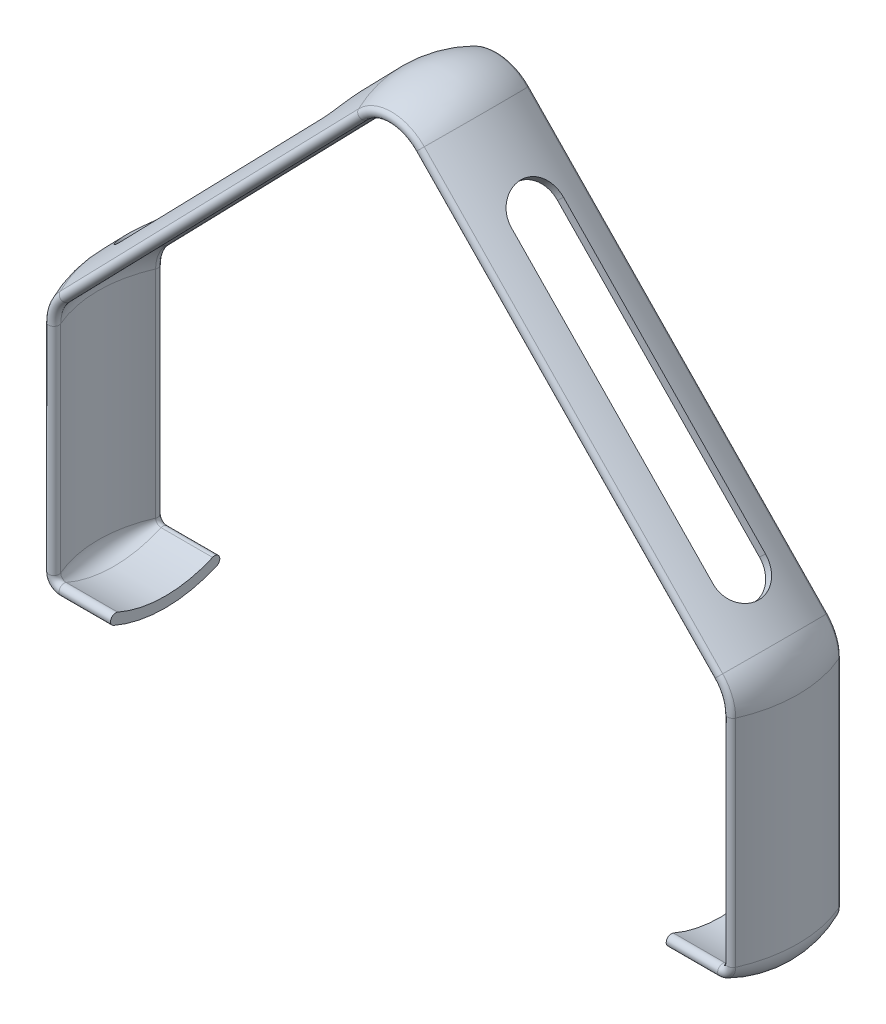
from build123d import *

# Parameters (mm, degrees)
CUT_EXTRUDE1_REACH      = 73.67
CUT_EXTRUDE1_END_RADIUS = 11.509727536


with BuildPart() as part:
    # Sweep3: sweep along a path in swept profile
    with BuildLine(Plane.XY) as sweep3_path:
        Line((27, 0), (32, 0))
        ThreePointArc((32, 0), (33.414213562, 0.585786438), (34, 2))
        Line((34, 2), (34, 22.971251236))
        ThreePointArc((34, 22.971251236), (33.633140648, 24.851146908), (32.586396904, 26.455179657))
        Line((32.586396904, 26.455179657), (3.586396904, 56.308120834))
        ThreePointArc((3.586396904, 56.308120834), (0, 57.824192412), (-3.586396904, 56.308120834))
        Line((-3.586396904, 56.308120834), (-32.586396904, 26.455179657))
        ThreePointArc((-32.586396904, 26.455179657), (-33.633140648, 24.851146908), (-34, 22.971251236))
        Line((-34, 22.971251236), (-34, 2))
        ThreePointArc((-34, 2), (-33.414213562, 0.585786438), (-32, 0))
        Line((-32, 0), (-27, 0))
    # guide line → Sweep3 (sweep)
    with BuildSketch(Plane(origin=(27, 0, 0), x_dir=(0, 0, -1), z_dir=(1, 0, 0))):
        with BuildLine():
            ThreePointArc((-5.010561558, 0.547286439), (0, -0.5), (5.010561558, 0.547286439))
            ThreePointArc((5.010561558, 0.547286439), (5.268436061, 1.20569417), (4.610028329, 1.463568673))
            ThreePointArc((4.610028329, 1.463568673), (0, 0.5), (-4.610028329, 1.463568673))
            ThreePointArc((-4.610028329, 1.463568673), (-5.268436061, 1.20569417), (-5.010561558, 0.547286439))
        make_face()
    sweep(path=sweep3_path.line)

    # Cut-Extrude1: up to this cylinder (the profile starts outside it)
    cut_extrude1_end = Plane(origin=(-10.201880326, 32.262165574, 0), z_dir=(-0.6967856842632488, -0.717279380859227, 0)) * Cylinder(CUT_EXTRUDE1_END_RADIUS, 171.359455073, mode=Mode.PRIVATE)
    # Sketch66 → Cut-Extrude1 (cut, up to the surface)
    with BuildSketch(Plane(origin=(-29.616848042, 28.770652384, 7.029029048), x_dir=(-0.6967856842632488, -0.717279380859227, 0), z_dir=(-0.7071067811865512, 0.6869037302955067, 0.16781914463526715)), mode=Mode.PRIVATE) as cut_extrude1_sk1:
        with BuildLine():
            Line((-30.115399458, -4.545589627), (-1.94952466, -4.545589627))
            ThreePointArc((-1.94952466, -4.545589627), (0.55579574, -7.050910027), (-1.94952466, -9.556230427))
            Line((-1.94952466, -9.556230427), (-30.115399458, -9.556230427))
            ThreePointArc((-30.115399458, -9.556230427), (-32.620719857, -7.050910027), (-30.115399458, -4.545589627))
        make_face()
    cut_extrude1_tool1 = extrude(cut_extrude1_sk1.sketch, amount=-CUT_EXTRUDE1_REACH, mode=Mode.PRIVATE) - cut_extrude1_end
    cut_extrude1 = cut_extrude1_tool1.solids().sort_by_distance((-19.294399, 41.094898, 0.078116))[0]
    add(cut_extrude1, mode=Mode.SUBTRACT)

    # Mirror1: Cut-Extrude1 across plane
    add(cut_extrude1.mirror(Plane(origin=(0, 0, 0), x_dir=(0, 0, 1), z_dir=(1, 0, 0))), mode=Mode.SUBTRACT)


solid = part.part
